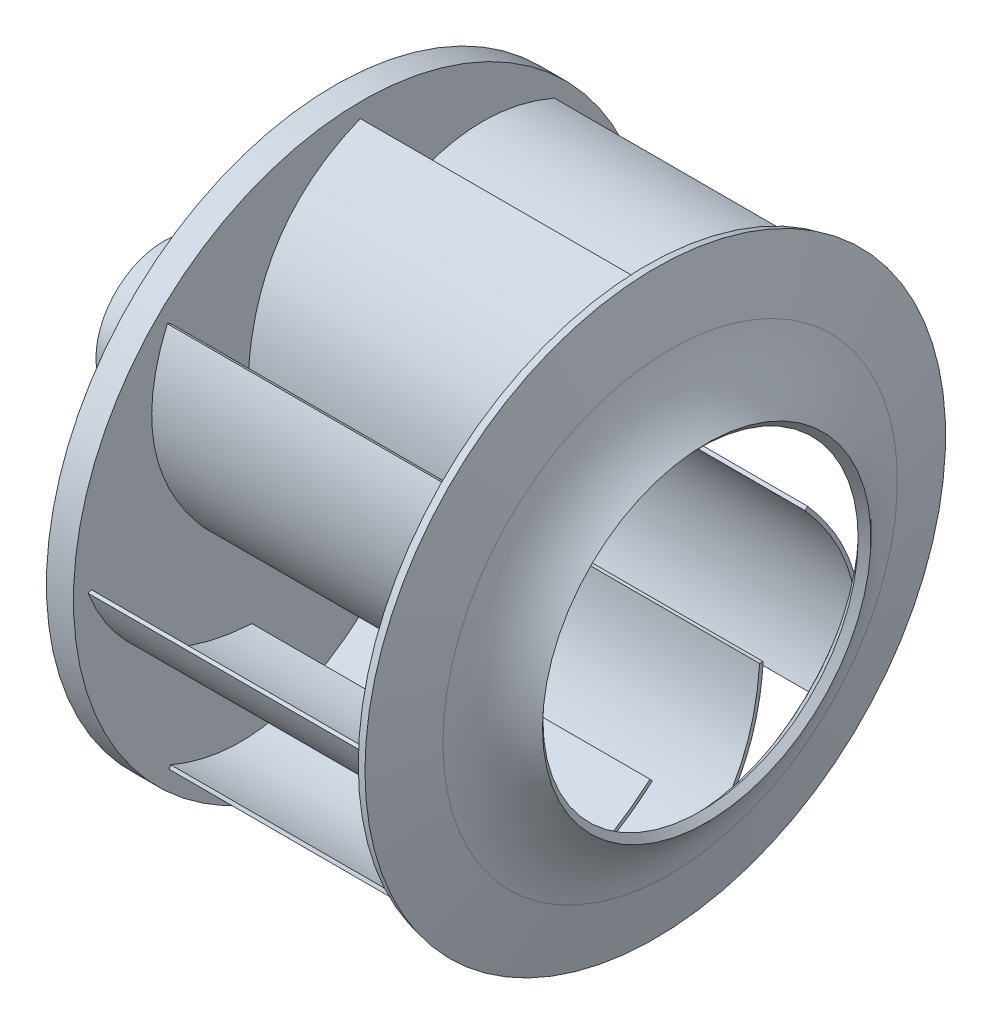
from build123d import *

# Parameters (mm, degrees)
SKETCH1_R           = 32
SKETCH1_R_2         = 2.5
BOSS_EXTRUDE1_DEPTH = 3
SKETCH2_R           = 7.5
SKETCH2_R_2         = 4.5
BOSS_EXTRUDE2_DEPTH = 19
BOSS_EXTRUDE3_REACH = 52.319
SKETCH3_W           = 5.65685425
SKETCH3_H           = 1
BOSS_EXTRUDE4_DEPTH = 32
CIRPATTERN1_COUNT   = 8
SKETCH6_R           = 2.5
BOSS_EXTRUDE5_DEPTH = 7


with BuildPart() as part:
    # Sketch1 → Boss-Extrude1 (new body)
    with BuildSketch(Plane(origin=(0, 0, 0), x_dir=(0, 0, -1), z_dir=(1, 0, 0))):
        Circle(SKETCH1_R)
        Circle(SKETCH1_R_2, mode=Mode.SUBTRACT)
    extrude(amount=BOSS_EXTRUDE1_DEPTH)

    # Sketch2 → Boss-Extrude2 (add)
    with BuildSketch(Plane.ZY):
        with Locations(Location((0, 0, 0), (0, 0, 180))):
            Circle(SKETCH2_R)
        Circle(SKETCH2_R_2, mode=Mode.SUBTRACT)
    extrude(amount=BOSS_EXTRUDE2_DEPTH)

    # Sketch3 → Boss-Extrude3 (add, up to next)
    with BuildSketch(Plane.ZY.offset(19), mode=Mode.PRIVATE) as boss_extrude3_sk1:
        with Locations((0, 4)):
            Rectangle(SKETCH3_W, SKETCH3_H)
    boss_extrude3_tool1 = extrude(boss_extrude3_sk1.sketch, amount=-BOSS_EXTRUDE3_REACH, mode=Mode.PRIVATE) - part.part
    add(boss_extrude3_tool1.solids().sort_by_distance((-19, 4, 0))[0])

    # Sketch4 → Boss-Extrude4 (add)
    with BuildSketch(Plane(origin=(3, 0, 0), x_dir=(0, 0, -1), z_dir=(1, 0, 0))):
        with BuildLine():
            Line((-21.58062512, 21.371321447), (-21.213203436, 21.213203436))
            add(Edge.make_bspline(
                [(-17.213203436, 0), (-26.020436099, 10.042549877), (-21.213203436, 21.213203436)],
                knots=[0, 0, 0, 1, 1, 1], degree=2))
            Line((-17.213203436, 0), (-17.51393709, -0.263740912))
            add(Edge.make_bspline(
                [(-17.51393709, -0.263740912), (-17.878739931, 0.152229786), (-18.596038958, 1.014035776), (-19.864700537, 2.724543787), (-21.192406768, 4.899599509), (-22.353083802, 7.549867519), (-23.082449138, 10.243922617), (-23.376476666, 12.977185386), (-23.235283471, 15.743890699), (-22.754370885, 18.077638215), (-22.157022424, 19.951191708), (-21.781093763, 20.905488834), (-21.58062512, 21.371321447)],
                knots=[0, 0, 0, 0, 0.0625, 0.125, 0.25, 0.375, 0.5, 0.625, 0.75, 0.875, 0.9375, 1, 1, 1, 1], degree=3))
        make_face()
    boss_extrude4 = extrude(amount=BOSS_EXTRUDE4_DEPTH)

    # CirPattern1: Boss-Extrude4 ×8 about axis
    cirpattern1_axis = Axis((3, 0, 0), (-1, 0, 0))
    for i in range(1, CIRPATTERN1_COUNT):
        add(boss_extrude4.rotate(cirpattern1_axis, i * 360 / CIRPATTERN1_COUNT))

    # Sketch5 → Revolve1 (revolve)
    with BuildSketch(Plane.XY, mode=Mode.PRIVATE) as revolve1_sk:
        with BuildLine():
            Line((36.269359104, 25), (34.615197821, 32))
            Line((34.615197821, 32), (35.588394389, 32.229974869))
            Line((35.588394389, 32.229974869), (37.242555672, 25.229974869))
            ThreePointArc((37.242555672, 25.229974869), (38.753955113, 21.430599527), (41.298671808, 18.229974869))
            Line((41.298671808, 18.229974869), (40.615197821, 17.5))
            ThreePointArc((40.615197821, 17.5), (37.888715648, 20.929240705), (36.269359104, 25))
        make_face()
    revolve(revolve1_sk.sketch.rotate(Axis((-14.357829548, 0, 0), (1, 0, 0)), 90), axis=Axis((-14.357829548, 0, 0), (1, 0, 0)))

    # Sketch6 → Boss-Extrude5 (add)
    with BuildSketch(Plane.ZY):
        with BuildLine():
            Line((-2.828427125, 3.5), (2.828427125, 3.5))
            ThreePointArc((2.828427125, 3.5), (0, -4.5), (-2.828427125, 3.5))
        make_face()
        Circle(SKETCH6_R, mode=Mode.SUBTRACT)
    extrude(amount=BOSS_EXTRUDE5_DEPTH)


solid = part.part
